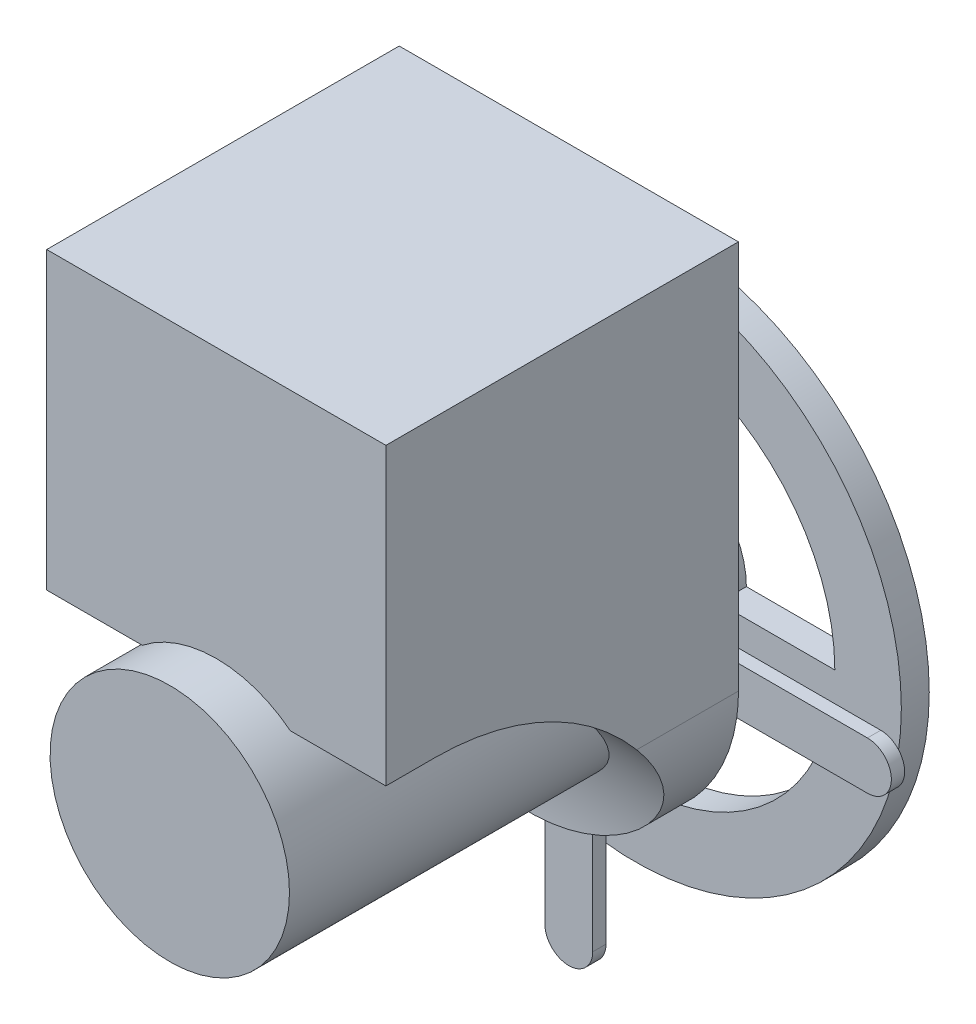
from build123d import *

# Parameters (mm, degrees)
SKETCH2_R               = 18
BOSS_EXTRUDE1_DEPTH     = 60
BOSS_EXTRUDE2_DEPTH     = 53
BOSS_EXTRUDE3_DEPTH     = 2
CUT_EXTRUDE3_DEPTH      = 97.822001632
CUT_EXTRUDE3_DEPTH_BACK = 97.822001632
BOSS_EXTRUDE4_START     = -56
SKETCH6_R               = 18
BOSS_EXTRUDE4_DEPTH     = 56
SKETCH8_R               = 3.017040472
BOSS_EXTRUDE5_DEPTH     = 10
SKETCH9_R               = 40
BOSS_EXTRUDE6_DEPTH     = 4.2
CUT_EXTRUDE4_DEPTH      = 104.317471969
CIRPATTERN1_COUNT       = 3


with BuildPart() as part:
    # Sketch2 → Boss-Extrude1 (new body)
    with BuildSketch(Plane.XY):
        Circle(SKETCH2_R)
    extrude(amount=BOSS_EXTRUDE1_DEPTH)

    # Sketch3 → Boss-Extrude2 (add)
    with BuildSketch(Plane.XY):
        with BuildLine():
            Line((-25.5, 0), (-25.5, 58.5))
            Line((-25.5, 58.5), (25.5, 58.5))
            Line((25.5, 58.5), (25.5, 0))
            ThreePointArc((25.5, 0), (0, -25.5), (-25.5, 0))
        make_face()
    extrude(amount=BOSS_EXTRUDE2_DEPTH)

    # Sketch4 → Boss-Extrude3 (add)
    with BuildSketch(Plane.XY):
        with BuildLine():
            Line((-3.6, 19.027416998), (-19.027416998, 3.6))
            Line((-19.027416998, 3.6), (-44.9, 3.6))
            ThreePointArc((-44.9, 3.6), (-48.5, 0), (-44.9, -3.6))
            Line((-44.9, -3.6), (-19.027416998, -3.6))
            Line((-19.027416998, -3.6), (-3.6, -19.027416998))
            Line((-3.6, -19.027416998), (-3.6, -44.9))
            ThreePointArc((-3.6, -44.9), (0, -48.5), (3.6, -44.9))
            Line((3.6, -44.9), (3.6, -19.027416998))
            Line((3.6, -19.027416998), (19.027416998, -3.6))
            Line((19.027416998, -3.6), (44.9, -3.6))
            ThreePointArc((44.9, -3.6), (48.5, 0), (44.9, 3.6))
            Line((44.9, 3.6), (19.027416998, 3.6))
            Line((19.027416998, 3.6), (3.6, 19.027416998))
            Line((3.6, 19.027416998), (3.6, 44.9))
            ThreePointArc((3.6, 44.9), (0, 48.5), (-3.6, 44.9))
            Line((-3.6, 44.9), (-3.6, 19.027416998))
        make_face()
    extrude(amount=-BOSS_EXTRUDE3_DEPTH)

    # Sketch5 → Cut-Extrude3 (cut, two sides: drawn at the far end of the back side and taken through both)
    with BuildSketch(Plane(origin=(0, 0, 0), x_dir=(0, 0, -1), z_dir=(1, 0, 0)).offset(-CUT_EXTRUDE3_DEPTH_BACK)):
        with BuildLine():
            Line((-53, 14.147312787), (-45.647312787, 14.147312787))
            ThreePointArc((-45.647312787, 14.147312787), (-17.612429059, 2.534883727), (-6, -25.5))
            Line((-6, -25.5), (-53, -25.5))
            Line((-53, -25.5), (-53, 14.147312787))
        make_face()
    extrude(amount=CUT_EXTRUDE3_DEPTH + CUT_EXTRUDE3_DEPTH_BACK, mode=Mode.SUBTRACT)

    # Sketch6 → Boss-Extrude4 (add)
    with BuildSketch(Plane.XY.offset(60).offset(BOSS_EXTRUDE4_START)):
        Circle(SKETCH6_R)
    extrude(amount=BOSS_EXTRUDE4_DEPTH)

    # Sketch8 → Boss-Extrude5 (add)
    with BuildSketch(Plane.XY):
        Circle(SKETCH8_R)
    extrude(amount=-BOSS_EXTRUDE5_DEPTH)

    # Sketch9 → Boss-Extrude6 (add)
    with BuildSketch(Plane(origin=(0, 0, -10), x_dir=(-1, 0, 0), z_dir=(0, 0, -1))):
        Circle(SKETCH9_R)
    extrude(amount=BOSS_EXTRUDE6_DEPTH)

    # Sketch11 → Cut-Extrude4 (cut, through all)
    with BuildSketch(Plane.XY.offset(-10)):
        with BuildLine():
            Line((12.5, 0), (30, 0))
            ThreePointArc((30, 0), (19.283628291, 22.981333294), (-5.20944533, 29.54423259))
            Line((-5.20944533, 29.54423259), (-2.170602221, 12.310096913))
            ThreePointArc((-2.170602221, 12.310096913), (8.034845121, 9.575555539), (12.5, 0))
        make_face()
    cut_extrude4 = extrude(amount=-CUT_EXTRUDE4_DEPTH, mode=Mode.SUBTRACT)

    # CirPattern1: Cut-Extrude4 ×3 about axis
    cirpattern1_axis = Axis((0, 0, -10), (0, 0, 1))
    for i in range(1, CIRPATTERN1_COUNT):
        add(cut_extrude4.rotate(cirpattern1_axis, i * 360 / CIRPATTERN1_COUNT), mode=Mode.SUBTRACT)


solid = part.part
